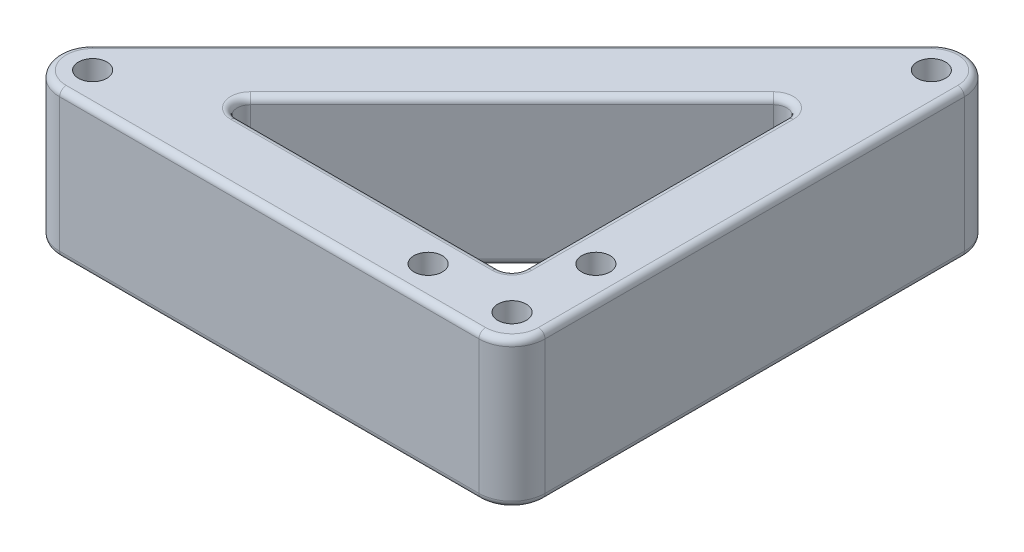
from build123d import *

# Parameters (mm, degrees)
SKETCH1_R           = 2.15
BOSS_EXTRUDE1_DEPTH = 22.2504
FILLET1_R           = 5
FILLET2_R           = 2
FILLET3_R           = 1


with BuildPart() as part:
    # Sketch1 → Boss-Extrude1 (new body)
    with BuildSketch(Plane(origin=(0, 0, 0), x_dir=(1, 0, 0), z_dir=(0, 1, 0))):
        with BuildLine():
            Line((59.964466094, 67.035533906), (-3.535533906, 3.535533906))
            ThreePointArc((-3.535533906, 3.535533906), (-4.619397663, -1.913417162), (0, -5))
            Line((0, -5), (68.5, -5))
            Line((68.5, -5), (68.5, 63.5))
            ThreePointArc((68.5, 63.5), (65.413417162, 68.119397663), (59.964466094, 67.035533906))
        make_face()
        Polygon((12.071067812, 5), (58.5, 51.428932188), (58.5, 5), align=None, mode=Mode.SUBTRACT)
        with Locations(Location((0, 0, 0), (0, 0, 90))):
            Circle(SKETCH1_R, mode=Mode.SUBTRACT)
        with Locations(Location((63.5, 63.5, 0), (0, 0, 90))):
            Circle(SKETCH1_R, mode=Mode.SUBTRACT)
        with Locations(Location((50.8, 0, 0), (0, 0, 90))):
            Circle(SKETCH1_R, mode=Mode.SUBTRACT)
        with Locations(Location((63.5, 0, 0), (0, 0, 90))):
            Circle(SKETCH1_R, mode=Mode.SUBTRACT)
        with Locations(Location((63.5, 12.7, 0), (0, 0, 90))):
            Circle(SKETCH1_R, mode=Mode.SUBTRACT)
    extrude(amount=BOSS_EXTRUDE1_DEPTH)

    # Fillet1
    fillet1_edges = [part.edges().sort_by_distance(p)[0] for p in [
        (68.5, 11.1252, 5),
    ]]
    fillet(fillet1_edges, radius=FILLET1_R)

    # Fillet2
    fillet2_edges = [part.edges().sort_by_distance(p)[0] for p in [
        (58.5, 11.1252, -5),
        (58.5, 11.1252, -51.428932188),
        (12.071067812, 11.1252, -5),
    ]]
    fillet(fillet2_edges, radius=FILLET2_R)

    # Fillet3
    fillet3_edges = [part.edges().sort_by_distance(p)[0] for p in [
        (68.5, 22.2504, -31.75),
        (65.413417162, 22.2504, -68.119397663),
        (31.75, 0, 5),
        (-4.619397663, 0, 1.913417162),
        (28.214466094, 22.2504, -35.285533906),
        (28.214466094, 0, -35.285533906),
        (65.413417162, 0, -68.119397663),
        (68.5, 0, -31.75),
        (-4.619397663, 22.2504, 1.913417162),
        (31.75, 22.2504, 5),
        (67.035533906, 0, 3.535533906),
        (67.035533906, 22.2504, 3.535533906),
        (58.5, 0, -26.800252532),
        (58.5, 22.2504, -26.800252532),
        (35.285533906, 0, -28.214466094),
        (35.285533906, 22.2504, -28.214466094),
        (36.699747468, 0, -5),
        (36.699747468, 22.2504, -5),
        (57.265366865, 0, -48.448264128),
        (57.265366865, 22.2504, -48.448264128),
        (57.914213562, 0, -5.585786438),
        (57.914213562, 22.2504, -5.585786438),
        (15.051735872, 0, -6.234633135),
        (15.051735872, 22.2504, -6.234633135),
    ]]
    fillet(fillet3_edges, radius=FILLET3_R)


solid = part.part
